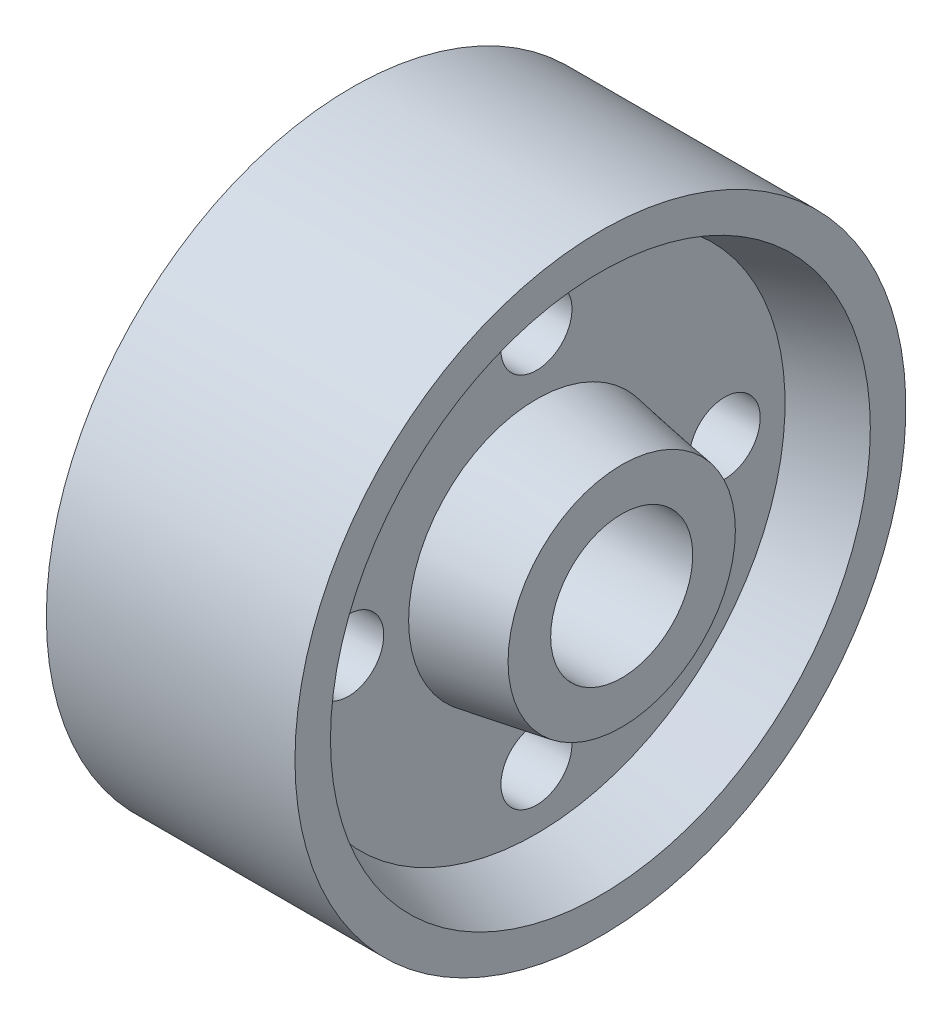
from build123d import *

# Parameters (mm, degrees)
SKETCH2_R          = 5
CUT_EXTRUDE1_DEPTH = 74.341666193
SKETCH3_R          = 10
CUT_EXTRUDE2_DEPTH = 74.341666193


with BuildPart() as part:
    # Sketch1 → Revolve1 (revolve)
    with BuildSketch(Plane(origin=(0, 0, 0), x_dir=(1, 0, 0), z_dir=(0, 1, 0)), mode=Mode.PRIVATE) as revolve1_sk:
        Polygon((0, 0), (0, 16), (12, 18), (12, 35), (3, 38), (3, 43), (38, 43), (38, 38), (29, 35), (29, 18), (41, 16), (41, 0), align=None)
    revolve(revolve1_sk.sketch.rotate(Axis((0, 0, 0), (1, 0, 0)), 180), axis=Axis((0, 0, 0), (1, 0, 0)))

    # Sketch2 → Cut-Extrude1 (cut, through all)
    with BuildSketch(Plane.ZY):
        with Locations((0, 26.5)):
            Circle(SKETCH2_R)
        with Locations((26.5, 0)):
            Circle(SKETCH2_R)
        with Locations((0, -26.5)):
            Circle(SKETCH2_R)
        with Locations((-26.5, 0)):
            Circle(SKETCH2_R)
    extrude(amount=-CUT_EXTRUDE1_DEPTH, mode=Mode.SUBTRACT)

    # Sketch3 → Cut-Extrude2 (cut, through all)
    with BuildSketch(Plane.ZY):
        Circle(SKETCH3_R)
    extrude(amount=-CUT_EXTRUDE2_DEPTH, mode=Mode.SUBTRACT)


solid = part.part
